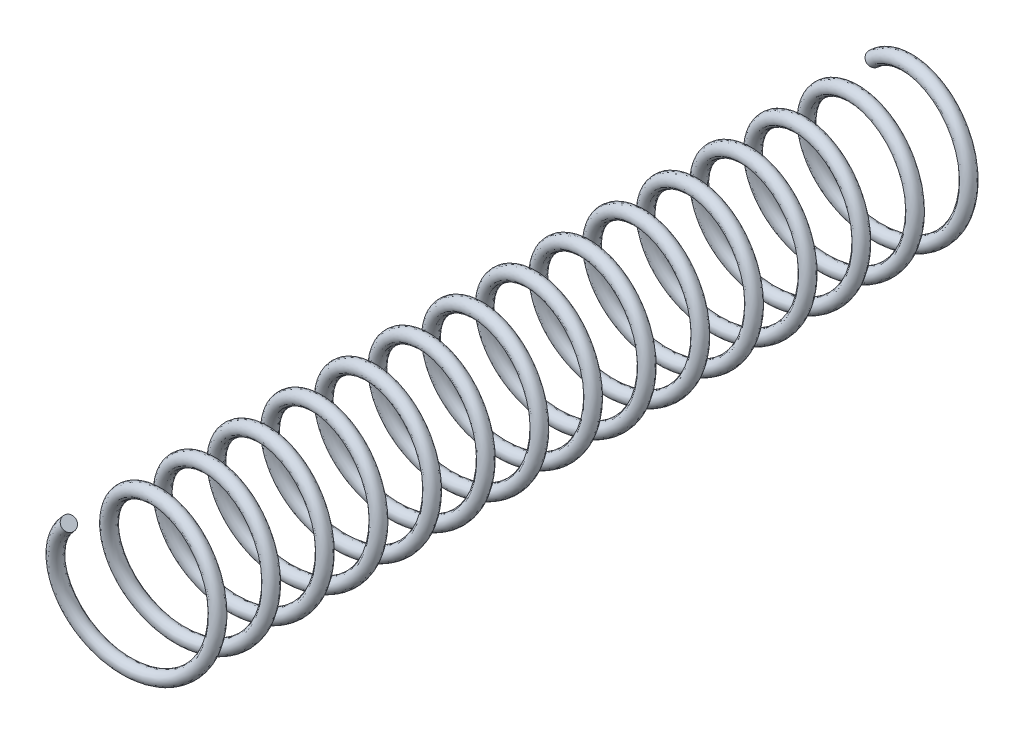
from build123d import *

# Parameters (mm, degrees)
SWEEP_1_PITCH       = 2
SWEEP_1_HEIGHT      = 30
SWEEP_1_RADIUS      = 2.5
SWEEP_1_START_ANGLE = 135
SWEEP_1_PROFILE_R   = 0.25


with BuildPart() as part:
    # 扫描1: sweep along a helix
    with BuildLine() as sweep_1_path:
        add(Helix(SWEEP_1_PITCH, SWEEP_1_HEIGHT, SWEEP_1_RADIUS, center=(0, 0, 0), direction=(0, 0, 1), lefthand=True, mode=Mode.PRIVATE).rotate(Axis((0, 0, 0), (0, 0, 1)), SWEEP_1_START_ANGLE))
    # 扫描1 profile (on start of the path) → 扫描1 (sweep)
    with BuildSketch(Plane(origin=(-1.767766953, 1.767766953, 0), x_dir=(-0.707106781186525, 0.7071067811865702, 0), z_dir=(0.7014439490181756, 0.7014439490181309, 0.12630428643413893))):
        Circle(SWEEP_1_PROFILE_R)
    sweep(path=sweep_1_path.line, is_frenet=True)


solid = part.part
